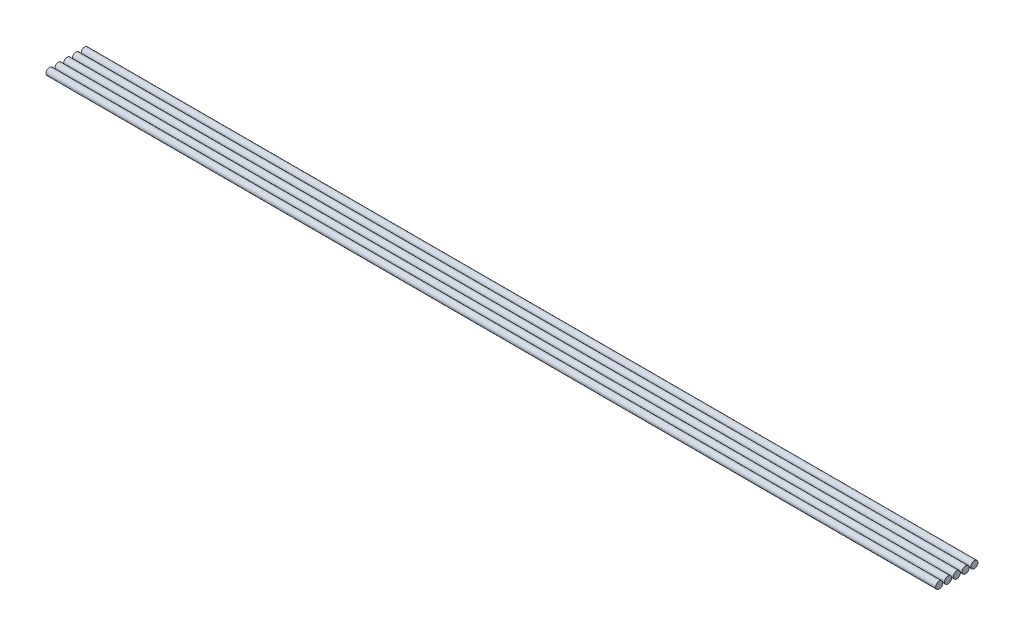
from build123d import *

# Parameters (mm, degrees)
SKETCH21_R = 0.4


with BuildPart() as part:
    # Sweep2: sweep along a path in Sketch3
    with BuildLine(Plane(origin=(0, 0, 0), x_dir=(1, 0, 0), z_dir=(0, 1, 0))) as sweep2_path:
        Line((0, -2), (101, -2))
    # Sketch21 → Sweep2 (sweep)
    with BuildSketch(Plane(origin=(0, 0, 0), x_dir=(0, 0, -1), z_dir=(1, 0, 0))):
        with Locations((2, 0)):
            Circle(SKETCH21_R)
        with Locations((1, 0)):
            Circle(SKETCH21_R)
        Circle(SKETCH21_R)
        with Locations((-1, 0)):
            Circle(SKETCH21_R)
        with Locations((-2, 0)):
            Circle(SKETCH21_R)
    sweep(path=sweep2_path.line)


solid = part.part
